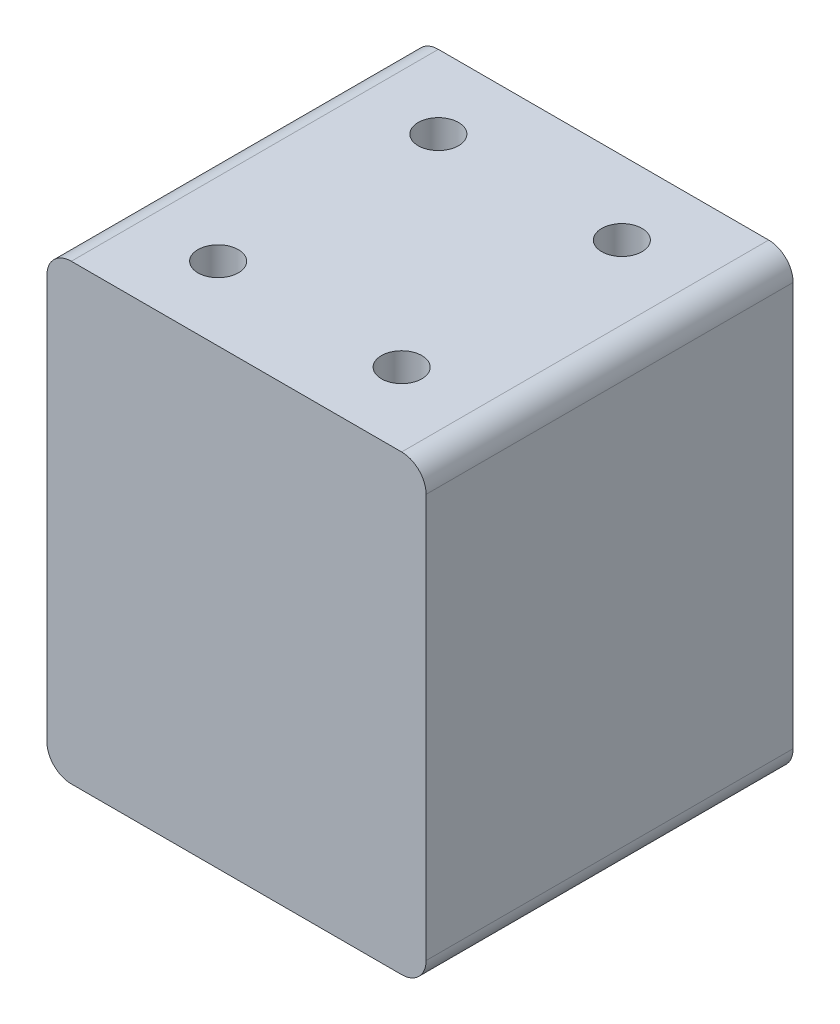
from build123d import *

# Parameters (mm, degrees)
SKETCH_1_W                  = 31
SKETCH_1_H                  = 37
EXTRUDE_1_DEPTH             = 30
HOLE_WIZARD_M4_1_AT_2_COUNT = 2
HOLE_WIZARD_M4_1_AT_2_PITCH = 15
HOLE_WIZARD_M4_1_AT_3_COUNT = 2
HOLE_WIZARD_M4_1_AT_3_PITCH = 23.430749028
HOLE_WIZARD_M4_1_AT_4_COUNT = 2
HOLE_WIZARD_M4_1_AT_4_PITCH = 18
HOLE_WIZARD_M4_2_D          = 3.3
HOLE_WIZARD_M4_2_DEPTH      = 10
HOLE_WIZARD_M4_2_TIP        = 0.991420021
SKETCH_8_R                  = 9.5
CUT_EXTRUDE_1_DEPTH         = 9.7
SKETCH_9_R                  = 8.65
CUT_EXTRUDE_2_DEPTH         = 3.3
FILLET_1_R                  = 2
CHAMFER_1_SIZE              = 1


with BuildPart() as part:
    # 草图1 → 凸台-拉伸1 (new body)
    with BuildSketch(Plane.XY):
        Rectangle(SKETCH_1_W, SKETCH_1_H)
    extrude(amount=EXTRUDE_1_DEPTH)

    # 草图4 → M4 螺纹孔1 (revolve, cut)
    with BuildSketch(Plane(origin=(-7.5, 18.5, 6), x_dir=(0, 0, 1), z_dir=(1, 0, 0))):
        Polygon((0, 0), (0, 9.991420021), (1.65, 9), (1.65, 0), align=None)
    hole_wizard_m4_1 = revolve(axis=Axis((-7.5, 24.85, 6), (0, -1, 0)), mode=Mode.SUBTRACT)

    # M4 螺纹孔1 at 2: M4 螺纹孔1 ×2
    with Locations(*[(i * HOLE_WIZARD_M4_1_AT_2_PITCH, 0, 0) for i in range(1, HOLE_WIZARD_M4_1_AT_2_COUNT)]):
        add(hole_wizard_m4_1, mode=Mode.SUBTRACT)

    # M4 螺纹孔1 at 3: M4 螺纹孔1 ×2
    with Locations(*[Vector(0.6401843996644799, 0, 0.7682212795973757) * (i * HOLE_WIZARD_M4_1_AT_3_PITCH) for i in range(1, HOLE_WIZARD_M4_1_AT_3_COUNT)]):
        add(hole_wizard_m4_1, mode=Mode.SUBTRACT)

    # M4 螺纹孔1 at 4: M4 螺纹孔1 ×2
    with Locations(*[(0, 0, i * HOLE_WIZARD_M4_1_AT_4_PITCH) for i in range(1, HOLE_WIZARD_M4_1_AT_4_COUNT)]):
        add(hole_wizard_m4_1, mode=Mode.SUBTRACT)

    # 镜向1: M4 螺纹孔1 across plane
    add(hole_wizard_m4_1.mirror(Plane.ZX), mode=Mode.SUBTRACT)

    # 镜向1 copy 1 sketch → 镜向1 copy 1 (revolve, cut)
    with BuildSketch(Plane(origin=(7.5, -18.5, 6), x_dir=(0, 0, 1), z_dir=(1, 0, 0))):
        Polygon((0, 0), (0, -9.991420021), (1.65, -9), (1.65, 0), align=None)
    revolve(axis=Axis((7.5, -24.85, 6), (0, -1, 0)), mode=Mode.SUBTRACT)

    # 镜向1 copy 2 sketch → 镜向1 copy 2 (revolve, cut)
    with BuildSketch(Plane(origin=(7.5, -18.5, 24), x_dir=(0, 0, 1), z_dir=(1, 0, 0))):
        Polygon((0, 0), (0, -9.991420021), (1.65, -9), (1.65, 0), align=None)
    revolve(axis=Axis((7.5, -24.85, 24), (0, -1, 0)), mode=Mode.SUBTRACT)

    # 镜向1 copy 3 sketch → 镜向1 copy 3 (revolve, cut)
    with BuildSketch(Plane(origin=(-7.5, -18.5, 24), x_dir=(0, 0, 1), z_dir=(1, 0, 0))):
        Polygon((0, 0), (0, -9.991420021), (1.65, -9), (1.65, 0), align=None)
    revolve(axis=Axis((-7.5, -24.85, 24), (0, -1, 0)), mode=Mode.SUBTRACT)

    # M4 螺纹孔2
    with Locations(Plane.ZY.offset(15.5)):
        with Locations((11, 12.5), (19, 12.5), (19, -12.5), (11, -12.5)):
            Hole(HOLE_WIZARD_M4_2_D / 2, depth=HOLE_WIZARD_M4_2_DEPTH)
            with Locations((0, 0, -(HOLE_WIZARD_M4_2_DEPTH + HOLE_WIZARD_M4_2_TIP / 2))):  # 118° drill point
                Cone(0, HOLE_WIZARD_M4_2_D / 2, HOLE_WIZARD_M4_2_TIP, mode=Mode.SUBTRACT)

    # 草图8 → 切除-拉伸1 (cut)
    with BuildSketch(Plane(origin=(0, 0, 0), x_dir=(-1, 0, 0), z_dir=(0, 0, -1))):
        Circle(SKETCH_8_R)
    extrude(amount=-CUT_EXTRUDE_1_DEPTH, mode=Mode.SUBTRACT)

    # 草图9 → 切除-拉伸2 (cut)
    with BuildSketch(Plane(origin=(0, 0, 9.7), x_dir=(-1, 0, 0), z_dir=(0, 0, -1))):
        Circle(SKETCH_9_R)
    extrude(amount=-CUT_EXTRUDE_2_DEPTH, mode=Mode.SUBTRACT)

    # 圆角1
    fillet_1_edges = [part.edges().sort_by_distance(p)[0] for p in [
        (15.5, -18.5, 15),
        (-15.5, -18.5, 15),
        (-15.5, 18.5, 15),
        (15.5, 18.5, 15),
    ]]
    fillet(fillet_1_edges, radius=FILLET_1_R)

    # 倒角1
    chamfer_1_edges = [part.edges().sort_by_distance(p)[0] for p in [
        (9.5, 0, 0),
    ]]
    chamfer(chamfer_1_edges, length=CHAMFER_1_SIZE)


solid = part.part
